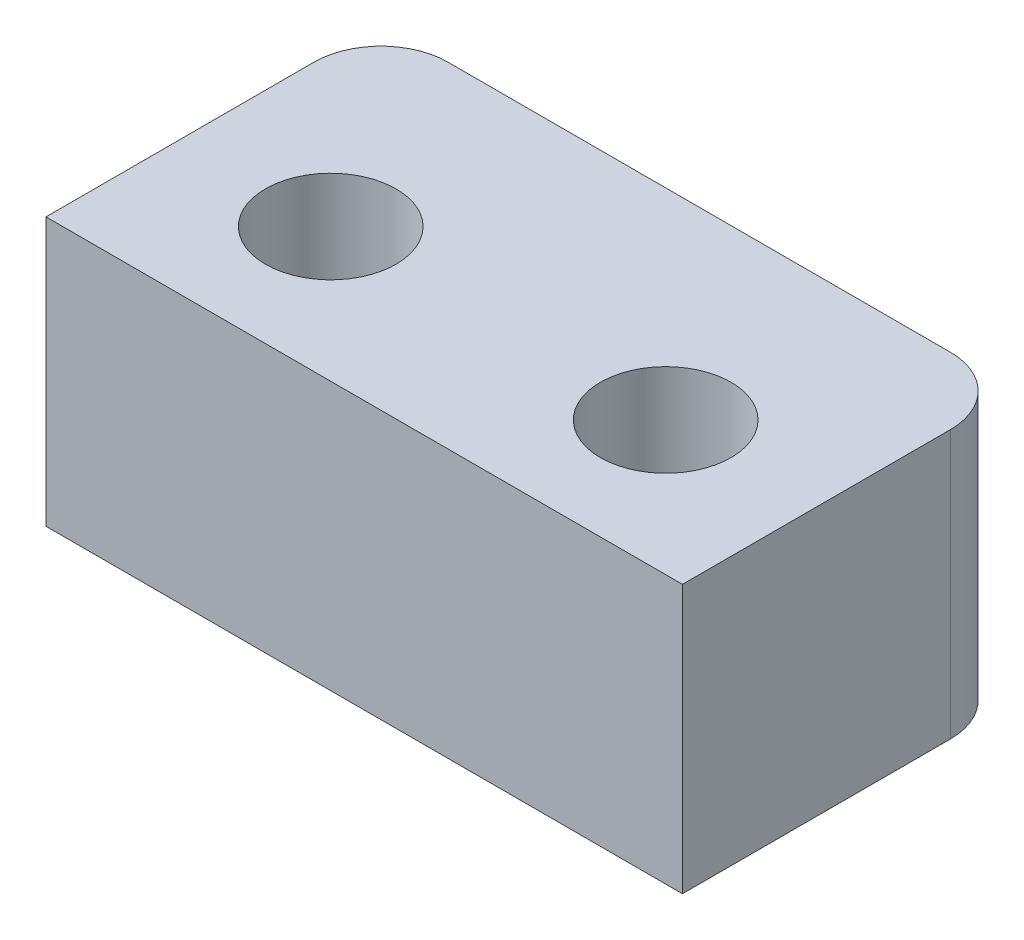
from build123d import *

# Parameters (mm, degrees)
SKETCH_1_W           = 30
SKETCH_1_H           = 15
EXTRUDE_1_DEPTH      = 8
FILLET_1_R           = 6
SKETCH_2_R           = 1.95
CUT_EXTRUDE_1_DEPTH  = 19.580904176
SKETCH_3_OUTSIDE_W   = 38.896
SKETCH_3_OUTSIDE_H   = 23.896
SKETCH_3_OUTSIDE_W_2 = 19
SKETCH_3_OUTSIDE_H_2 = 10
CUT_EXTRUDE_3_DEPTH  = 10
FILLET_3_R           = 2


with BuildPart() as part:
    # Эскиз1 → Бобышка-Вытянуть1 (new body)
    with BuildSketch(Plane(origin=(0, 0, 0), x_dir=(1, 0, 0), z_dir=(0, 1, 0))):
        Rectangle(SKETCH_1_W, SKETCH_1_H)
    extrude(amount=EXTRUDE_1_DEPTH)

    # Скругление1
    fillet_1_edges = [part.edges().sort_by_distance(p)[0] for p in [
        (-15, 4, -7.5),
        (15, 4, -7.5),
    ]]
    fillet(fillet_1_edges, radius=FILLET_1_R)

    # Эскиз2 → Вырез-Вытянуть1 (cut, through all)
    with BuildSketch(Plane(origin=(0, 8, 0), x_dir=(1, 0, 0), z_dir=(0, 1, 0))):
        with Locations(Location((-5, -3.5, 0), (0, 0, 270))):
            Circle(SKETCH_2_R)
        with Locations(Location((5, -3.5, 0), (0, 0, 270))):
            Circle(SKETCH_2_R)
    extrude(amount=-CUT_EXTRUDE_1_DEPTH, mode=Mode.SUBTRACT)

    # Эскиз3 outside → Вырез-Вытянуть3 (cut)
    with BuildSketch(Plane(origin=(0, 8, 0), x_dir=(1, 0, 0), z_dir=(0, 1, 0))):
        Rectangle(SKETCH_3_OUTSIDE_W, SKETCH_3_OUTSIDE_H)
        with Locations((0, -2.5)):
            Rectangle(SKETCH_3_OUTSIDE_W_2, SKETCH_3_OUTSIDE_H_2, mode=Mode.SUBTRACT)
    extrude(amount=-CUT_EXTRUDE_3_DEPTH, mode=Mode.SUBTRACT)

    # Скругление3
    fillet_3_edges = [part.edges().sort_by_distance(p)[0] for p in [
        (-9.5, 4, -2.5),
        (9.5, 4, -2.5),
    ]]
    fillet(fillet_3_edges, radius=FILLET_3_R)


solid = part.part
